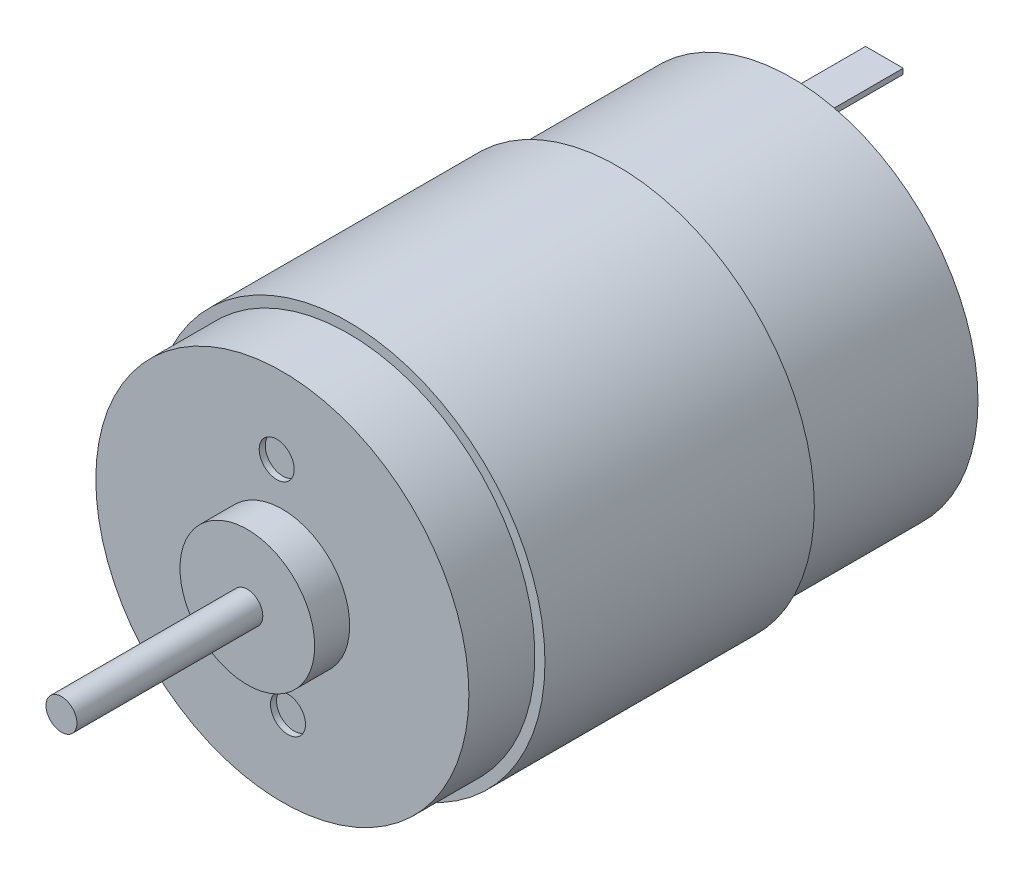
from build123d import *

# Parameters (mm, degrees)
SKETCH_1_R          = 13.85
EXTRUDE_1_DEPTH     = 37.8
SKETCH_2_R          = 5
EXTRUDE_2_DEPTH     = 2.6
EXTRUDE_START       = -2.6
SKETCH_3_R          = 1.15
EXTRUDE_3_DEPTH     = 16.4
EXTRUDE_START_2     = -32.9
SKETCH_4_R          = 14.6
EXTRUDE_4_DEPTH     = 20
EXTRUDE_START_3     = 2.6
SKETCH_5_R          = 5
EXTRUDE_5_DEPTH     = 2.6
SKETCH_6_W          = 2.8
SKETCH_6_H          = 0.4
EXTRUDE_6_DEPTH     = 6.9
SKETCH_7_R          = 1.3
CUT_EXTRUDE_1_DEPTH = 0.45


with BuildPart() as part:
    # ｽｹｯﾁ1 → ﾎﾞｽ - 押し出し1 (new body)
    with BuildSketch(Plane.XY):
        Circle(SKETCH_1_R)
    extrude(amount=EXTRUDE_1_DEPTH)

    # ｽｹｯﾁ2 → ﾎﾞｽ - 押し出し2 (add)
    with BuildSketch(Plane.XY.offset(37.8)):
        Circle(SKETCH_2_R)
    extrude(amount=EXTRUDE_2_DEPTH)

    # ｽｹｯﾁ3 → ﾎﾞｽ - 押し出し3 (add)
    with BuildSketch(Plane.XY.offset(40.4).offset(EXTRUDE_START)):
        Circle(SKETCH_3_R)
    extrude(amount=EXTRUDE_3_DEPTH)

    # ｽｹｯﾁ4 → ﾎﾞｽ - 押し出し4 (add)
    with BuildSketch(Plane(origin=(0, 0, 0), x_dir=(-1, 0, 0), z_dir=(0, 0, -1)).offset(EXTRUDE_START_2)):
        Circle(SKETCH_4_R)
    extrude(amount=EXTRUDE_4_DEPTH)

    # ｽｹｯﾁ5 → ﾎﾞｽ - 押し出し5 (add)
    with BuildSketch(Plane(origin=(0, 0, 0), x_dir=(-1, 0, 0), z_dir=(0, 0, -1)).offset(EXTRUDE_START_3)):
        with Locations(Location((0, 0, 0), (0, 0, 180))):
            Circle(SKETCH_5_R)
    extrude(amount=-EXTRUDE_5_DEPTH)

    # ｽｹｯﾁ6 → ﾎﾞｽ - 押し出し6 (add)
    with BuildSketch(Plane(origin=(0, 0, 0), x_dir=(-1, 0, 0), z_dir=(0, 0, -1))):
        with Locations((0, 11.5)):
            Rectangle(SKETCH_6_W, SKETCH_6_H)
        with Locations((0, -11.5)):
            Rectangle(SKETCH_6_W, SKETCH_6_H)
    extrude(amount=EXTRUDE_6_DEPTH)

    # ｽｹｯﾁ7 → ｶｯﾄ - 押し出し1 (cut)
    with BuildSketch(Plane.XY.offset(37.8)):
        with Locations((-0.41868765, 7.989036278)):
            Circle(SKETCH_7_R)
        with Locations(Location((0.41868765, -7.989036278, 0), (0, 0, 180))):
            Circle(SKETCH_7_R)
    extrude(amount=-CUT_EXTRUDE_1_DEPTH, mode=Mode.SUBTRACT)


solid = part.part
